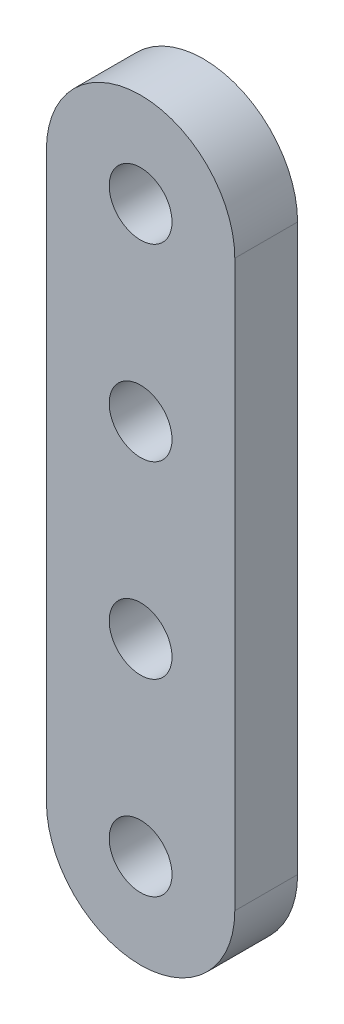
from build123d import *

# Parameters (mm, degrees)
MODEL_R                 = 1.5
SALIENTE_EXTRUIR1_DEPTH = 3


with BuildPart() as part:
    # Model → Saliente-Extruir1 (new body)
    with BuildSketch(Plane.XY):
        with BuildLine():
            Line((213.25077615, 152.428489513), (213.25077615, 179.428489513))
            ThreePointArc((213.25077615, 179.428489513), (208.75077615, 183.928489513), (204.25077615, 179.428489513))
            Line((204.25077615, 179.428489513), (204.25077615, 152.428489513))
            ThreePointArc((204.25077615, 152.428489513), (208.75077615, 147.928489513), (213.25077615, 152.428489513))
        make_face()
        with Locations((208.75077615, 152.428489513)):
            Circle(MODEL_R, mode=Mode.SUBTRACT)
        with Locations((208.75077615, 161.428489513)):
            Circle(MODEL_R, mode=Mode.SUBTRACT)
        with Locations((208.75077615, 170.428489513)):
            Circle(MODEL_R, mode=Mode.SUBTRACT)
        with Locations((208.75077615, 179.428489513)):
            Circle(MODEL_R, mode=Mode.SUBTRACT)
    extrude(amount=SALIENTE_EXTRUIR1_DEPTH)


solid = part.part
